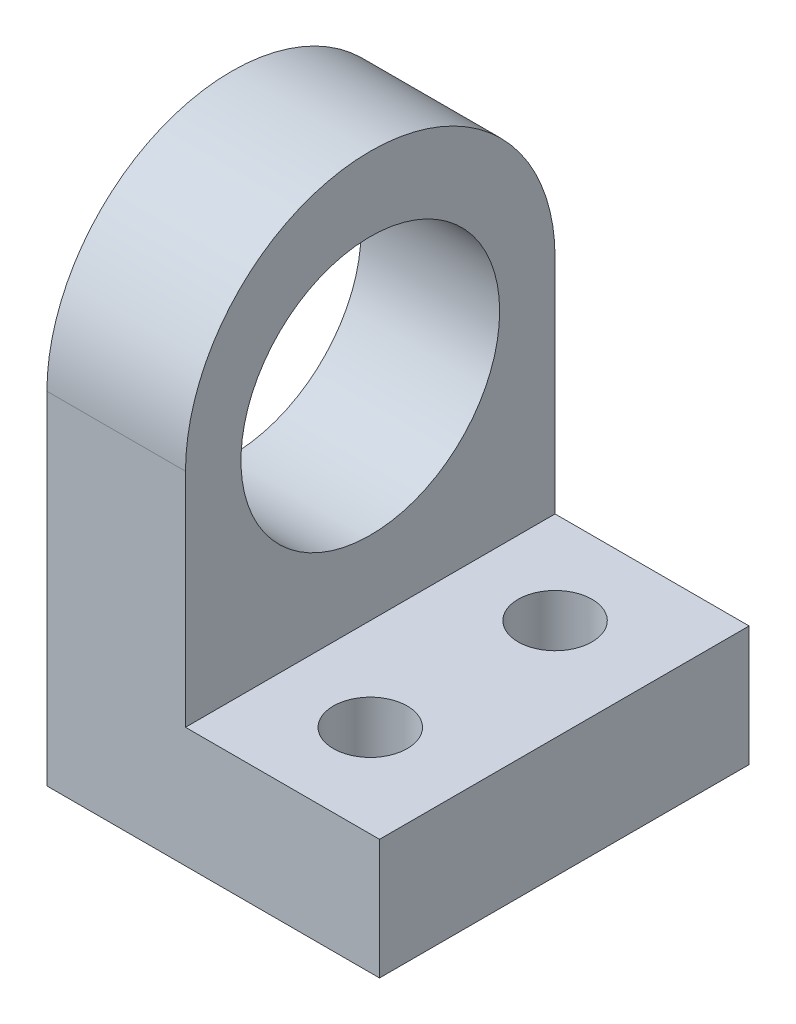
from build123d import *

# Parameters (mm, degrees)
BOSS_EXTRUDE5_DEPTH = 40
FILLET4_RADIUS      = 20
FILLET4_LENGTH      = 15
SKETCH8_R           = 14
CUT_EXTRUDE1_DEPTH  = 40
SKETCH9_R           = 4
CUT_EXTRUDE2_DEPTH  = 40


with BuildPart() as part:
    # Sketch1 → Boss-Extrude5 (new body)
    with BuildSketch(Plane.XY):
        Polygon((-36, 44), (-36, -13), (0, -13), (0, 0), (-21, 0), (-21, 44), align=None)
    extrude(amount=BOSS_EXTRUDE5_DEPTH)

    # Fillet4: full round fillet: the end face becomes a half cylinder, R = half its width
    fillet4_face = Plane((-28.5, 44, 20), x_dir=(1, 0, 0), z_dir=(0, 1, 0))  # on the end face: x along it, z out of the body
    fillet4_slab = fillet4_face.offset(-FILLET4_RADIUS / 2) * Box(FILLET4_LENGTH, 2 * FILLET4_RADIUS, FILLET4_RADIUS, mode=Mode.PRIVATE)  # the body's end, R deep
    fillet4_round = Plane((-28.5, 24, 20), x_dir=(0, 1, 0), z_dir=(1, 0, 0)) * Cylinder(FILLET4_RADIUS, FILLET4_LENGTH, mode=Mode.PRIVATE)  # its axis R under the face
    add(fillet4_slab - fillet4_round, mode=Mode.SUBTRACT)

    # Sketch8 → Cut-Extrude1 (cut)
    with BuildSketch(Plane(origin=(-21, 0, 0), x_dir=(0, 0, -1), z_dir=(1, 0, 0))):
        with Locations((-20, 22)):
            Circle(SKETCH8_R)
    extrude(amount=-CUT_EXTRUDE1_DEPTH, mode=Mode.SUBTRACT)

    # Sketch9 → Cut-Extrude2 (cut)
    with BuildSketch(Plane(origin=(0, 0, 0), x_dir=(1, 0, 0), z_dir=(0, 1, 0))):
        with Locations(Location((-11, -10, 0), (0, 0, 180))):
            Circle(SKETCH9_R)
        with Locations(Location((-11, -30, 0), (0, 0, 180))):
            Circle(SKETCH9_R)
    extrude(amount=-CUT_EXTRUDE2_DEPTH, mode=Mode.SUBTRACT)


solid = part.part
